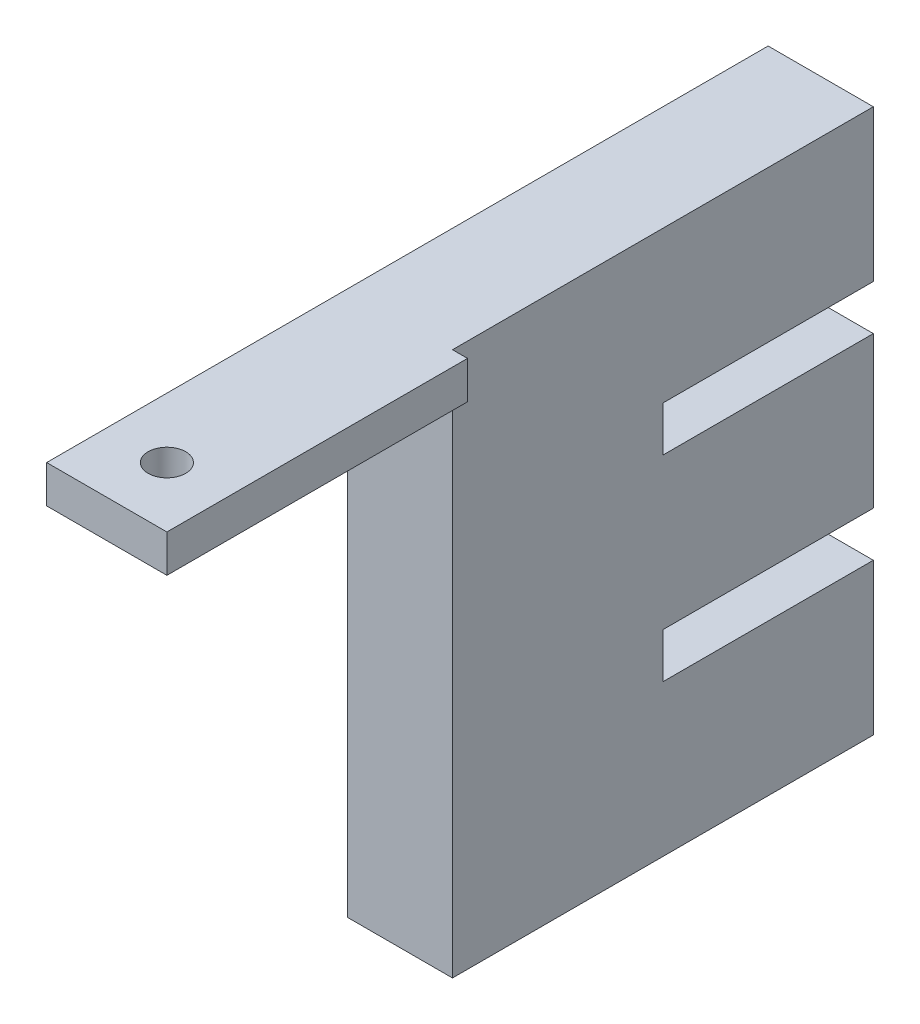
from build123d import *

# Parameters (mm, degrees)
S_BOX1_W       = 8
S_BOX1_H       = 2.5
BOSS_1_DEPTH   = 20
S_BOX2_W       = 7
S_BOX2_H       = 36.2
BOSS_2_DEPTH   = 28
S_HOLE3_R      = 1.25
HOLE_3_DEPTH   = 2.7
S_CUT4_W       = 7.2
S_CUT4_H       = 3
POCKET_4_DEPTH = 14.1
S_CUT5_W       = 7.2
S_CUT5_H       = 3
POCKET_5_DEPTH = 14.1


with BuildPart() as part:
    # S_box1 → Boss_1 (new body)
    with BuildSketch(Plane.XY.offset(-16)):
        with Locations((0, 3.25)):
            Rectangle(S_BOX1_W, S_BOX1_H)
    extrude(amount=BOSS_1_DEPTH)

    # S_box2 → Boss_2 (add)
    with BuildSketch(Plane.XY.offset(-44)):
        with Locations((-0.5, -13.6)):
            Rectangle(S_BOX2_W, S_BOX2_H)
    extrude(amount=BOSS_2_DEPTH)

    # S_hole3 → Hole_3 (cut)
    with BuildSketch(Plane(origin=(0, 1.9, 0), x_dir=(1, 0, 0), z_dir=(0, 1, 0))):
        with Locations(Location((0, 0, 0), (0, 0, 90))):
            Circle(S_HOLE3_R)
    extrude(amount=HOLE_3_DEPTH, mode=Mode.SUBTRACT)

    # S_cut4 → Pocket_4 (cut)
    with BuildSketch(Plane.XY.offset(-44.1)):
        with Locations((-0.5, -7.07)):
            Rectangle(S_CUT4_W, S_CUT4_H)
    extrude(amount=POCKET_4_DEPTH, mode=Mode.SUBTRACT)

    # S_cut5 → Pocket_5 (cut)
    with BuildSketch(Plane.XY.offset(-44.1)):
        with Locations((-0.5, -20.13)):
            Rectangle(S_CUT5_W, S_CUT5_H)
    extrude(amount=POCKET_5_DEPTH, mode=Mode.SUBTRACT)


solid = part.part
